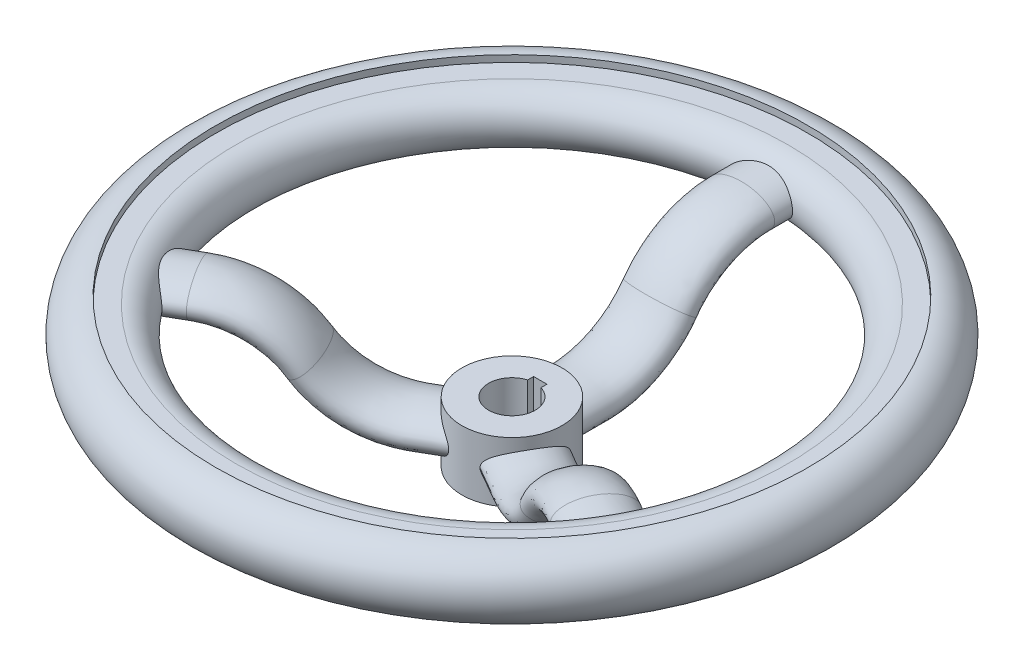
from build123d import *

# Parameters (mm, degrees)
ESBO_O8_RX            = 10
ESBO_O8_RY            = 5.5
PADR_OCIRCULAR1_COUNT = 3
ESBO_O9_W             = 7
ESBO_O9_H             = 18
ESBO_O9_4_W           = 8
ESBO_O9_4_H           = 18
CORTE_EXTRUS_O1_REACH = 144.031


with BuildPart() as part:
    # Esboço1 → Revolução1 (revolve)
    with BuildSketch(Plane(origin=(0, 0, 0), x_dir=(0, 0, -1), z_dir=(1, 0, 0))):
        with BuildLine():
            Line((88.733971724, 33), (82.733971724, 33))
            ThreePointArc((82.733971724, 33), (74.733971724, 25), (82.733971724, 17))
            Line((82.733971724, 17), (88.733971724, 17))
            Line((88.733971724, 17), (88.733971724, 15))
            ThreePointArc((88.733971724, 15), (98.733971724, 25), (88.733971724, 35))
            Line((88.733971724, 35), (88.733971724, 33))
        make_face()
    revolve(axis=Axis((0, 100, 0), (0, -1, 0)))

    # Varredura10: sweep along a curve in space
    with BuildLine() as varredura10_path:
        Line((0, 25, -68.733971724), (0, 25, -88.733971724))
        ThreePointArc((0, 25, -68.733971724), (0, 21.69269563, -55.040907786), (0, 12.5, -44.366985862))
        ThreePointArc((0, 0, -20), (0, 3.30730437, -33.693063938), (0, 12.5, -44.366985862))
        Line((0, 0, -20), (0, 0, 0))
    # Esboço8 → Varredura10 (sweep)
    with BuildSketch(Plane.XY.offset(-20)):
        with Locations(Location((0, 0), (0, 0, -180))):
            Ellipse(ESBO_O8_RX, ESBO_O8_RY)
    varredura10 = sweep(path=varredura10_path.line)

    # PadrãoCircular1: Varredura10 ×3 about axis
    padr_ocircular1_axis = Axis((0, 100, 0), (0, -1, 0))
    for i in range(1, PADR_OCIRCULAR1_COUNT):
        add(varredura10.rotate(padr_ocircular1_axis, i * 360 / PADR_OCIRCULAR1_COUNT))

    # Esboço9 → Corte-Revolução1 (revolve, cut)
    with BuildSketch(Plane(origin=(0, 0, 0), x_dir=(0, 0, -1), z_dir=(1, 0, 0))):
        with Locations((3.5, 0)):
            Rectangle(ESBO_O9_W, ESBO_O9_H)
    revolve(axis=Axis((0, 100, 0), (0, -1, 0)), mode=Mode.SUBTRACT)

    # Esboço9<4> → Revolução3 (revolve)
    with BuildSketch(Plane(origin=(0, 0, 0), x_dir=(0, 0, -1), z_dir=(1, 0, 0))):
        with Locations((11, 0)):
            Rectangle(ESBO_O9_4_W, ESBO_O9_4_H)
    revolve(axis=Axis((0, 100, 0), (0, -1, 0)))

    # Esboço10 → Corte-extrusão1 (cut, up to next)
    with BuildSketch(Plane(origin=(0, 9, 0), x_dir=(1, 0, 0), z_dir=(0, 1, 0)), mode=Mode.PRIVATE) as corte_extrus_o1_sk1:
        with BuildLine():
            Line((-2, 6.708203932), (-2, 8.5))
            Line((-2, 8.5), (2, 8.5))
            Line((2, 8.5), (2, 6.708203932))
            ThreePointArc((2, 6.708203932), (0, 7), (-2, 6.708203932))
        make_face()
    corte_extrus_o1_tool1 = extrude(corte_extrus_o1_sk1.sketch, amount=-CORTE_EXTRUS_O1_REACH, mode=Mode.PRIVATE) & part.part
    add(corte_extrus_o1_tool1.solids().sort_by_distance((0, 9, -7.699424))[0], mode=Mode.SUBTRACT)


solid = part.part
